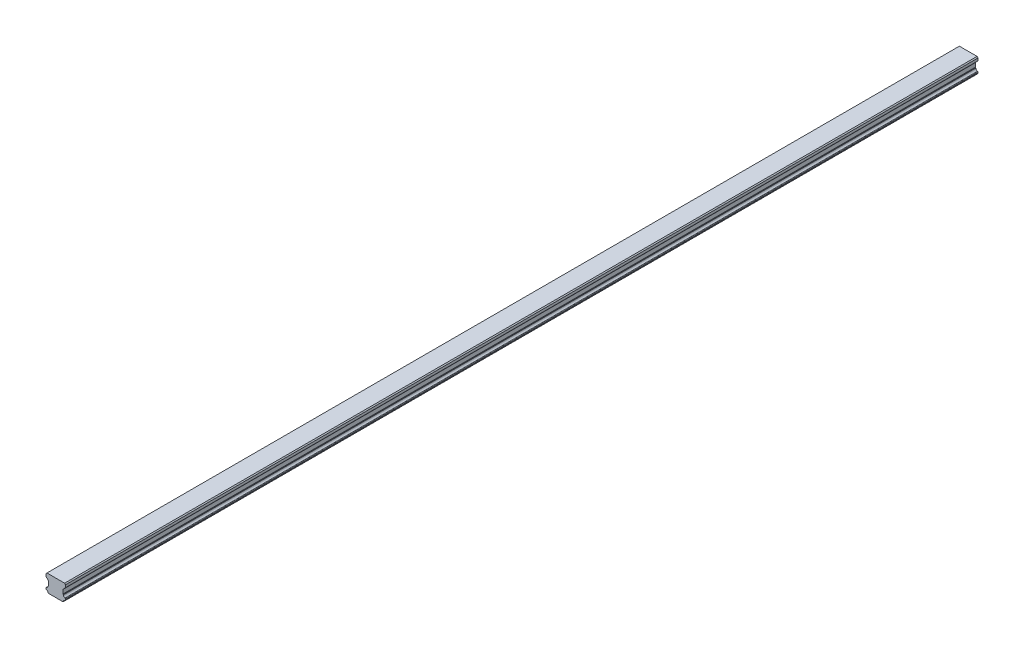
from build123d import *

# Parameters (mm, degrees)
EXTRUDE_1_DEPTH = 700


with BuildPart() as part:
    # Эскиз1 → Бобышка-Вытянуть1 (new body)
    with BuildSketch(Plane.XY):
        with BuildLine():
            Line((-5.46985211, -7.411045604), (5.730145315, -7.411041789))
            Line((5.730145315, -7.411041789), (5.854638028, -7.286549685))
            ThreePointArc((5.854638028, -7.286549685), (5.911937364, -7.20635235), (5.940153705, -7.111913668))
            ThreePointArc((5.940153705, -7.111913668), (6.341942581, -6.285154294), (7.163841877, -5.873514998))
            ThreePointArc((7.163841877, -5.873514998), (7.300953358, -5.817703777), (7.394683615, -5.703121539))
            Line((7.394683615, -5.703121539), (7.630144215, -5.198183147))
            Line((7.630144215, -5.198183147), (7.630144215, -4.724329082))
            Line((7.630144215, -4.724329082), (7.394687631, -4.219406111))
            ThreePointArc((7.394687631, -4.219406111), (7.300956391, -4.104822605), (7.163843431, -4.049010766))
            ThreePointArc((7.163843431, -4.049010766), (6.316412668, -3.610860037), (5.932837044, -2.737370082))
            ThreePointArc((5.932837044, -2.737370082), (5.906391792, -2.634548817), (5.845788955, -2.547377378))
            Line((5.845788955, -2.547377378), (5.718010589, -2.419605844))
            ThreePointArc((5.718010589, -2.419605844), (5.652979011, -2.322279213), (5.630142958, -2.207474624))
            Line((5.630142958, -2.207474624), (5.630140678, 0.76469716))
            ThreePointArc((5.630140678, 0.76469716), (5.652977343, 0.879503392), (5.718010579, 0.976830996))
            Line((5.718010579, 0.976830996), (7.542273692, 2.80109288))
            ThreePointArc((7.542273692, 2.80109288), (7.607305679, 2.898420128), (7.630141876, 3.013225444))
            Line((7.630141876, 3.013225444), (7.630143411, 4.874732859))
            Line((7.630143411, 4.874732859), (6.915919245, 5.5889632))
            Line((6.915919245, 5.5889632), (-6.655632424, 5.5889632))
            Line((-6.655632424, 5.5889632), (-7.369856589, 4.874732859))
            Line((-7.369856589, 4.874732859), (-7.36985352, 3.01322547))
            ThreePointArc((-7.36985352, 3.01322547), (-7.347017561, 2.898420809), (-7.281986205, 2.801093969))
            Line((-7.281986205, 2.801093969), (-5.457722471, 0.976831278))
            ThreePointArc((-5.457722471, 0.976831278), (-5.392689614, 0.879504241), (-5.369853082, 0.764698676))
            Line((-5.369853082, 0.764698676), (-5.369850196, -2.207473107))
            ThreePointArc((-5.369850196, -2.207473107), (-5.392686546, -2.322278688), (-5.457718941, -2.419606012))
            Line((-5.457718941, -2.419606012), (-5.58549549, -2.547377941))
            ThreePointArc((-5.58549549, -2.547377941), (-5.646097371, -2.63454755), (-5.672542868, -2.737366636))
            ThreePointArc((-5.672542868, -2.737366636), (-6.056117526, -3.610859609), (-6.903549853, -4.049012485))
            ThreePointArc((-6.903549853, -4.049012485), (-7.040661794, -4.104823909), (-7.134392337, -4.219406564))
            Line((-7.134392337, -4.219406564), (-7.369851244, -4.724329406))
            Line((-7.369851244, -4.724329406), (-7.369851244, -5.198181564))
            Line((-7.369851244, -5.198181564), (-7.134391321, -5.703121225))
            ThreePointArc((-7.134391321, -5.703121225), (-7.040660935, -5.817703621), (-6.903549265, -5.873514919))
            ThreePointArc((-6.903549265, -5.873514919), (-6.081649939, -6.285154158), (-5.679860891, -7.111913449))
            ThreePointArc((-5.679860891, -7.111913449), (-5.65164477, -7.206351932), (-5.594345742, -7.286549177))
            Line((-5.594345742, -7.286549177), (-5.46985211, -7.411045604))
        make_face()
    extrude(amount=EXTRUDE_1_DEPTH)


solid = part.part
